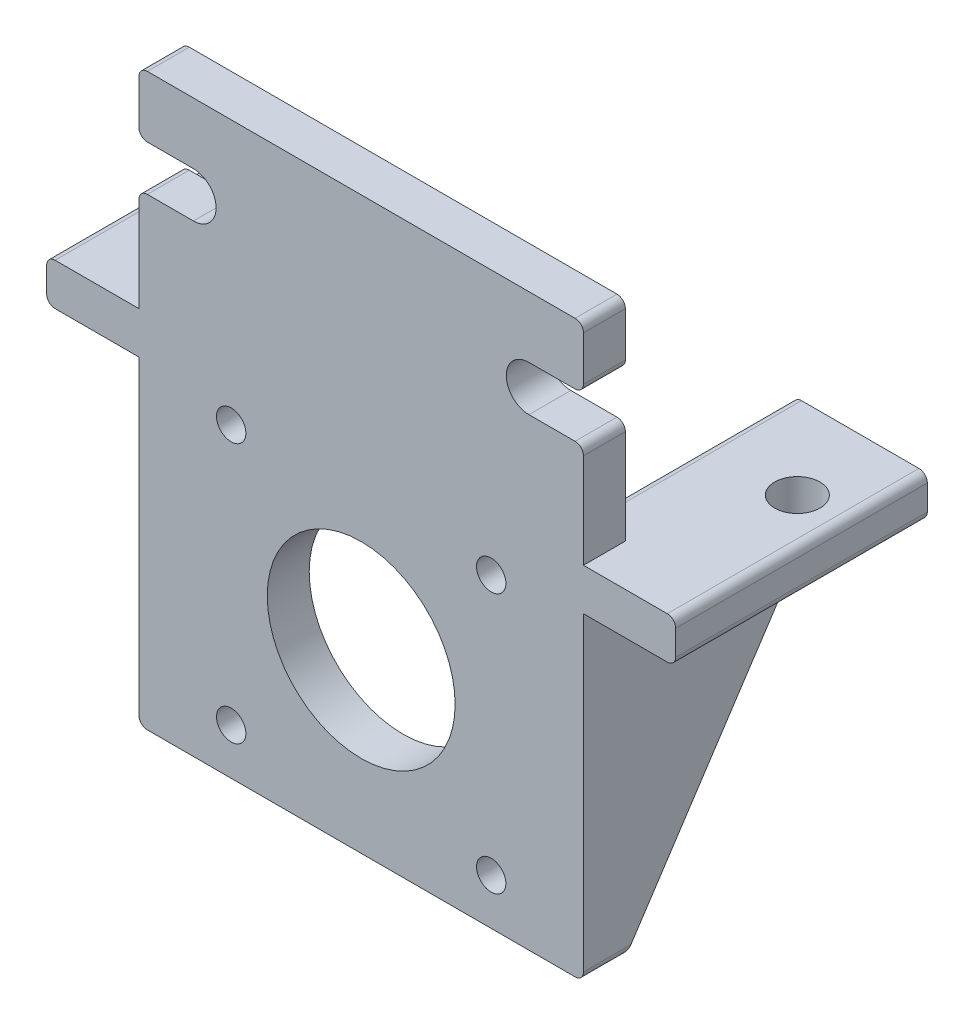
from build123d import *

# Parameters (mm, degrees)
SKETCH1_R           = 11.2
SKETCH1_R_2         = 1.75
BOSS_EXTRUDE1_DEPTH = 5
BOSS_EXTRUDE2_DEPTH = 25
CUT_EXTRUDE1_DEPTH  = 77.661594035
SKETCH4_R           = 2.7
CUT_EXTRUDE2_DEPTH  = 25
FILLET1_R           = 1
BOSS_EXTRUDE3_DEPTH = 5
BOSS_EXTRUDE4_DEPTH = 5


with BuildPart() as part:
    # Sketch1 → Boss-Extrude1 (new body)
    with BuildSketch(Plane.XY):
        with BuildLine():
            Line((26.5, 34), (-26.5, 34))
            Line((-26.5, 34), (-26.5, 26.7))
            Line((-26.5, 26.7), (-20, 26.7))
            ThreePointArc((-20, 26.7), (-17.3, 24), (-20, 21.3))
            Line((-20, 21.3), (-26.5, 21.3))
            Line((-26.5, 21.3), (-26.5, -34))
            Line((-26.5, -34), (26.5, -34))
            Line((26.5, -34), (26.5, 21.3))
            Line((26.5, 21.3), (20, 21.3))
            ThreePointArc((20, 21.3), (17.3, 24), (20, 26.7))
            Line((20, 26.7), (26.5, 26.7))
            Line((26.5, 26.7), (26.5, 34))
        make_face()
        with Locations((0, -13)):
            Circle(SKETCH1_R, mode=Mode.SUBTRACT)
        with Locations((15.5, 2.5)):
            Circle(SKETCH1_R_2, mode=Mode.SUBTRACT)
        with Locations(Location((15.5, -28.5, 0), (0, 0, 180))):
            Circle(SKETCH1_R_2, mode=Mode.SUBTRACT)
        with Locations(Location((-15.5, 2.5, 0), (0, 0, 180))):
            Circle(SKETCH1_R_2, mode=Mode.SUBTRACT)
        with Locations((-15.5, -28.5)):
            Circle(SKETCH1_R_2, mode=Mode.SUBTRACT)
    extrude(amount=BOSS_EXTRUDE1_DEPTH)

    # Sketch2 → Boss-Extrude2 (add)
    with BuildSketch(Plane(origin=(0, 0, 0), x_dir=(-1, 0, 0), z_dir=(0, 0, -1))):
        Polygon((26.5, -34), (21.5, -34), (21.5, 9), (37.5, 9), (37.5, 4), (26.5, 4), align=None)
        Polygon((-26.5, 4), (-26.5, -34), (-21.5, -34), (-21.5, 9), (-37.5, 9), (-37.5, 4), align=None)
    extrude(amount=BOSS_EXTRUDE2_DEPTH)

    # Sketch3 → Cut-Extrude1 (cut, through all)
    with BuildSketch(Plane.ZY.offset(26.5)):
        Polygon((-25, 4), (0, -34), (-25, -34), align=None)
    extrude(amount=-CUT_EXTRUDE1_DEPTH, mode=Mode.SUBTRACT)

    # Sketch4 → Cut-Extrude2 (cut)
    with BuildSketch(Plane.XZ.offset(-4)):
        with Locations((32, -15)):
            Circle(SKETCH4_R)
        with Locations(Location((-32, -15, 0), (0, 0, 270))):
            Circle(SKETCH4_R)
    extrude(amount=-CUT_EXTRUDE2_DEPTH, mode=Mode.SUBTRACT)

    # Fillet1
    fillet1_edges = [part.edges().sort_by_distance(p)[0] for p in [
        (-26.5, 21.3, 2.5),
        (-26.5, 26.7, 2.5),
        (26.5, 21.3, 2.5),
        (26.5, 26.7, 2.5),
        (26.5, 34, 2.5),
        (26.5, -34, 2.5),
        (-26.5, -34, 2.5),
        (-26.5, 34, 2.5),
        (-37.5, 4, -12.5),
        (-37.5, 9, -12.5),
        (-21.5, 9, -12.5),
        (21.5, 9, -12.5),
        (37.5, 4, -12.5),
        (37.5, 9, -12.5),
    ]]
    fillet(fillet1_edges, radius=FILLET1_R)

    # Sketch5 → Boss-Extrude3 (add)
    with BuildSketch(Plane.XY):
        with BuildLine():
            Line((26.5, 4), (36.5, 4))
            ThreePointArc((36.5, 4), (37.207106781, 4.292893219), (37.5, 5))
            Line((37.5, 5), (37.5, 8))
            ThreePointArc((37.5, 8), (37.207106781, 8.707106781), (36.5, 9))
            Line((36.5, 9), (26.5, 9))
            Line((26.5, 9), (26.5, 4))
        make_face()
    extrude(amount=BOSS_EXTRUDE3_DEPTH)

    # Sketch6 → Boss-Extrude4 (add)
    with BuildSketch(Plane.XY):
        with BuildLine():
            Line((-37.5, 8), (-37.5, 5))
            ThreePointArc((-37.5, 5), (-37.207106781, 4.292893219), (-36.5, 4))
            Line((-36.5, 4), (-26.5, 4))
            Line((-26.5, 4), (-26.5, 9))
            Line((-26.5, 9), (-36.5, 9))
            ThreePointArc((-36.5, 9), (-37.207106781, 8.707106781), (-37.5, 8))
        make_face()
    extrude(amount=BOSS_EXTRUDE4_DEPTH)


solid = part.part
